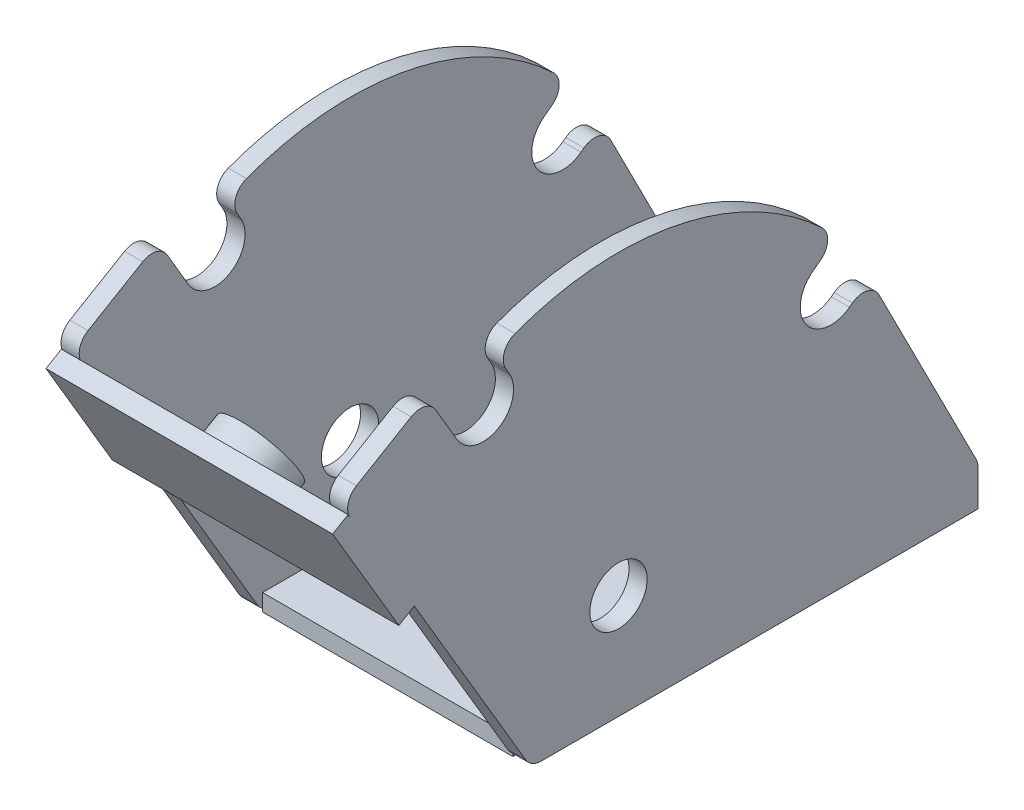
from build123d import *

# Parameters (mm, degrees)
SKETCH1_W           = 35.56
SKETCH1_H           = 63.5
SKETCH1_R           = 3.0734
BOSS_EXTRUDE1_DEPTH = 2.4003
SKETCH2_R           = 4.07035
BOSS_EXTRUDE2_DEPTH = 2.5781
SKETCH3_W           = 40.7162
SKETCH3_H           = 18.5166
BOSS_EXTRUDE3_DEPTH = 2.54
SKETCH4_R           = 5.5626
BOSS_EXTRUDE4_DEPTH = 3.7846


with BuildPart() as part:
    # Sketch1 → Boss-Extrude1 (new body)
    with BuildSketch(Plane(origin=(0, 0, 0), x_dir=(1, 0, 0), z_dir=(0, 1, 0))):
        Rectangle(SKETCH1_W, SKETCH1_H)
        with Locations(Location((-11.0109, 18.288, 0), (0, 0, 270))):
            Circle(SKETCH1_R, mode=Mode.SUBTRACT)
        with Locations(Location((-11.0109, -22.225, 0), (0, 0, 270))):
            Circle(SKETCH1_R, mode=Mode.SUBTRACT)
        with Locations(Location((11.0109, -22.225, 0), (0, 0, 90))):
            Circle(SKETCH1_R, mode=Mode.SUBTRACT)
        with Locations(Location((11.0109, 18.288, 0), (0, 0, 90))):
            Circle(SKETCH1_R, mode=Mode.SUBTRACT)
    extrude(amount=BOSS_EXTRUDE1_DEPTH)

    # Sketch2 → Boss-Extrude2 (add)
    with BuildSketch(Plane(origin=(17.78, 0, 0), x_dir=(0, 0, -1), z_dir=(1, 0, 0))):
        with BuildLine():
            Line((31.75, 0), (31.75, 5.119118053))
            ThreePointArc((31.75, 5.119118053), (31.680088236, 5.710949198), (31.474201493, 6.270200848))
            Line((31.474201493, 6.270200848), (17.693567666, 33.376966591))
            ThreePointArc((17.693567666, 33.376966591), (16.006303844, 34.699493087), (13.908046107, 34.259890987))
            Line((13.908046107, 34.259890987), (13.489778208, 33.947050723))
            ThreePointArc((13.489778208, 33.947050723), (7.374615324, 34.828872577), (8.256437178, 40.944035461))
            Line((8.256437178, 40.944035461), (9.378285973, 41.783113656))
            ThreePointArc((9.378285973, 41.783113656), (10.39301658, 43.675533493), (9.59524257, 45.66914521))
            ThreePointArc((9.59524257, 45.66914521), (-10.963994808, 56.277959645), (-34.028081087, 54.467680828))
            ThreePointArc((-34.028081087, 54.467680828), (-35.535691357, 52.940715566), (-35.336051172, 50.80421014))
            Line((-35.336051172, 50.80421014), (-34.816573654, 49.916114029))
            ThreePointArc((-34.816573654, 49.916114029), (-36.36360729, 44.008751256), (-42.270970063, 45.555784893))
            Line((-42.270970063, 45.555784893), (-45.277675805, 50.696033664))
            ThreePointArc((-45.277675805, 50.696033664), (-46.831353511, 51.871946179), (-48.760952094, 51.601143727))
            Line((-48.760952094, 51.601143727), (-56.540301411, 47.010806757))
            ThreePointArc((-56.540301411, 47.010806757), (-57.70907124, 45.457347112), (-57.437054463, 43.532440191))
            Line((-57.437054463, 43.532440191), (-32.487107654, 1.249193243))
            ThreePointArc((-32.487107654, 1.249193243), (-31.559101504, 0.334297259), (-30.299547846, 0))
            Line((-30.299547846, 0), (31.75, 0))
        make_face()
        with Locations((-19.316644044, 14.86535)):
            Circle(SKETCH2_R, mode=Mode.SUBTRACT)
    boss_extrude2 = extrude(amount=BOSS_EXTRUDE2_DEPTH)

    # Mirror1: Boss-Extrude2 across plane
    add(boss_extrude2.mirror(Plane.ZY))

    # Sketch3 → Boss-Extrude3 (add)
    with BuildSketch(Plane(origin=(0, -13.896244991, 23.550285021), x_dir=(1, 0, 0), z_dir=(0, -0.5081916365877369, 0.8612440191387559))):
        with Locations((0, 58.016828481)):
            Rectangle(SKETCH3_W, SKETCH3_H)
    extrude(amount=BOSS_EXTRUDE3_DEPTH)

    # Sketch4 → Boss-Extrude4 (add)
    with BuildSketch(Plane(origin=(0, -13.896244991, 23.550285021), x_dir=(-1, 0, 0), z_dir=(0, 0.5081916365877371, -0.8612440191387557))):
        with Locations(Location((0, 58.016828481, 0), (0, 0, 90))):
            Circle(SKETCH4_R)
    extrude(amount=BOSS_EXTRUDE4_DEPTH)


solid = part.part
